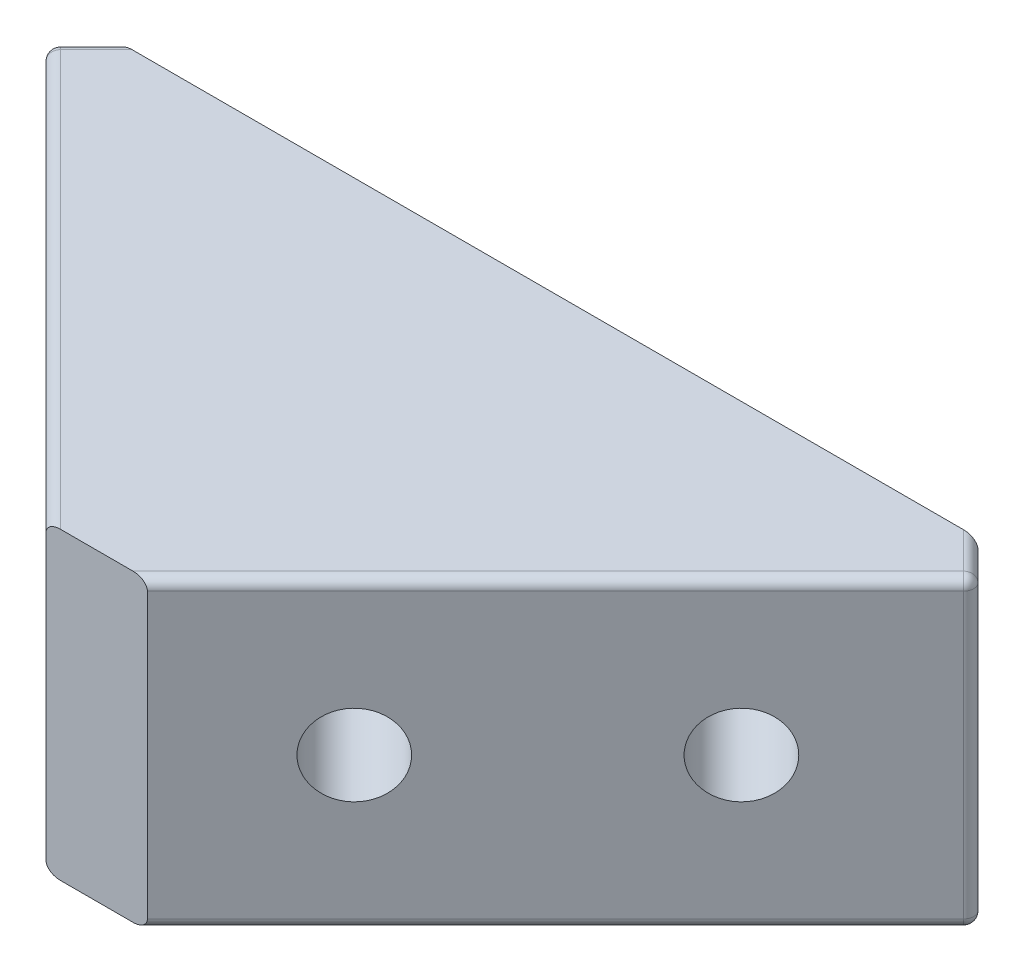
from build123d import *

# Parameters (mm, degrees)
BOSS_EXTRUDE1_DEPTH = 15
CUT_EXTRUDE5_REACH  = 43.908
SKETCH9_R           = 2
CUT_EXTRUDE6_REACH  = 43.908
SKETCH10_R          = 2
CUT_EXTRUDE7_REACH  = 40.079
FILLET1_R           = 0.5
CUT_EXTRUDE8_REACH  = 39.141
SKETCH11_R          = 3.5
CUT_EXTRUDE9_REACH  = 39.141
SKETCH12_R          = 3.5


with BuildPart() as part:
    # Sketch1 → Boss-Extrude1 (new body)
    with BuildSketch(Plane(origin=(0, 0, 0), x_dir=(1, 0, 0), z_dir=(0, 1, 0))):
        Polygon((-24.748737342, 0), (24.748737342, 0), (0, -24.748737342), align=None)
    extrude(amount=BOSS_EXTRUDE1_DEPTH)

    # Cut-Extrude5: up to this plane
    cut_extrude5_end = Plane(origin=(-24.748737342, 15, 0), z_dir=(0, 0, 1))
    # Sketch9 → Cut-Extrude5 (cut, up to the surface)
    with BuildSketch(Plane(origin=(12.374368671, 0, 12.374368671), x_dir=(0.7071067811865474, 0, -0.7071067811865477), z_dir=(0.7071067811865477, 0, 0.7071067811865474)), mode=Mode.PRIVATE) as cut_extrude5_sk1:
        with Locations((-6.75, 7.5)):
            Circle(SKETCH9_R)
    cut_extrude5_tool1 = split(extrude(cut_extrude5_sk1.sketch, amount=-CUT_EXTRUDE5_REACH, mode=Mode.PRIVATE), bisect_by=cut_extrude5_end, keep=Keep.BOTH, mode=Mode.PRIVATE)
    add(cut_extrude5_tool1.solids().sort_by_distance((7.601398, 7.5, 17.147339))[0], mode=Mode.SUBTRACT)
    # Sketch9 → Cut-Extrude5 (cut, up to the surface)
    with BuildSketch(Plane(origin=(12.374368671, 0, 12.374368671), x_dir=(0.7071067811865474, 0, -0.7071067811865477), z_dir=(0.7071067811865477, 0, 0.7071067811865474)), mode=Mode.PRIVATE) as cut_extrude5_sk2:
        with Locations((6.75, 7.5)):
            Circle(SKETCH9_R)
    cut_extrude5_tool2 = split(extrude(cut_extrude5_sk2.sketch, amount=-CUT_EXTRUDE5_REACH, mode=Mode.PRIVATE), bisect_by=cut_extrude5_end, keep=Keep.BOTH, mode=Mode.PRIVATE)
    add(cut_extrude5_tool2.solids().sort_by_distance((17.147339, 7.5, 7.601398))[0], mode=Mode.SUBTRACT)

    # Cut-Extrude6: up to this plane
    cut_extrude6_end = Plane(origin=(-24.748737342, 15, 0), z_dir=(0, 0, 1))
    # Sketch10 → Cut-Extrude6 (cut, up to the surface)
    with BuildSketch(Plane(origin=(-12.374368671, 0, 12.374368671), x_dir=(0.7071067811865472, 0, 0.7071067811865479), z_dir=(-0.7071067811865479, 0, 0.7071067811865472)), mode=Mode.PRIVATE) as cut_extrude6_sk1:
        with Locations((-6.75, 7.5)):
            Circle(SKETCH10_R)
    cut_extrude6_tool1 = split(extrude(cut_extrude6_sk1.sketch, amount=-CUT_EXTRUDE6_REACH, mode=Mode.PRIVATE), bisect_by=cut_extrude6_end, keep=Keep.BOTH, mode=Mode.PRIVATE)
    add(cut_extrude6_tool1.solids().sort_by_distance((-17.147339, 7.5, 7.601398))[0], mode=Mode.SUBTRACT)
    # Sketch10 → Cut-Extrude6 (cut, up to the surface)
    with BuildSketch(Plane(origin=(-12.374368671, 0, 12.374368671), x_dir=(0.7071067811865472, 0, 0.7071067811865479), z_dir=(-0.7071067811865479, 0, 0.7071067811865472)), mode=Mode.PRIVATE) as cut_extrude6_sk2:
        with Locations(Location((6.75, 7.5, 0), (0, 0, 90))):
            Circle(SKETCH10_R)
    cut_extrude6_tool2 = split(extrude(cut_extrude6_sk2.sketch, amount=-CUT_EXTRUDE6_REACH, mode=Mode.PRIVATE), bisect_by=cut_extrude6_end, keep=Keep.BOTH, mode=Mode.PRIVATE)
    add(cut_extrude6_tool2.solids().sort_by_distance((-7.601398, 7.5, 17.147339))[0], mode=Mode.SUBTRACT)

    # Sketch3 → Cut-Extrude7 (cut, up to next)
    with BuildSketch(Plane.XZ, mode=Mode.PRIVATE) as cut_extrude7_sk1:
        Polygon((-2.5, 22.248737342), (0, 24.748737342), (2.5, 22.248737342), align=None)
    cut_extrude7_tool1 = extrude(cut_extrude7_sk1.sketch, amount=-CUT_EXTRUDE7_REACH, mode=Mode.PRIVATE) & part.part
    # Sketch3 → Cut-Extrude7 (cut, up to next)
    with BuildSketch(Plane.XZ, mode=Mode.PRIVATE) as cut_extrude7_sk2:
        Polygon((-24.748737342, 0), (-22.980970389, 1.767766953), (-21.213203436, 0), align=None)
    cut_extrude7_tool2 = extrude(cut_extrude7_sk2.sketch, amount=-CUT_EXTRUDE7_REACH, mode=Mode.PRIVATE) & part.part
    # Sketch3 → Cut-Extrude7 (cut, up to next)
    with BuildSketch(Plane.XZ, mode=Mode.PRIVATE) as cut_extrude7_sk3:
        Polygon((24.748737342, 0), (21.213203436, 0), (22.980970389, 1.767766953), align=None)
    cut_extrude7_tool3 = extrude(cut_extrude7_sk3.sketch, amount=-CUT_EXTRUDE7_REACH, mode=Mode.PRIVATE) & part.part
    add(cut_extrude7_tool1.solids().sort_by_distance((0, 0, 23.082071))[0], mode=Mode.SUBTRACT)
    add(cut_extrude7_tool2.solids().sort_by_distance((-22.98097, 0, 0.589256))[0], mode=Mode.SUBTRACT)
    add(cut_extrude7_tool3.solids().sort_by_distance((22.98097, 0, 0.589256))[0], mode=Mode.SUBTRACT)

    # Fillet1
    fillet1_edges = [part.edges().sort_by_distance(p)[0] for p in [
        (-12.740485194, 0, 12.008252147),
        (12.740485194, 0, 12.008252147),
        (-12.740485194, 15, 12.008252147),
        (12.740485194, 15, 12.008252147),
        (22.980970389, 7.5, 1.767766953),
        (22.097086912, 15, 0.883883476),
        (22.097086912, 0, 0.883883476),
        (-22.097086912, 15, 0.883883476),
        (-22.980970389, 7.5, 1.767766953),
        (-22.097086912, 0, 0.883883476),
    ]]
    fillet(fillet1_edges, radius=FILLET1_R)

    # Cut-Extrude8: up to this plane
    cut_extrude8_end = Plane(origin=(-24.748737342, 15, 0), z_dir=(0, 0, 1))
    # Sketch11 → Cut-Extrude8 (cut, up to the surface)
    with BuildSketch(Plane(origin=(-8.131727984, 0, 8.131727984), x_dir=(0.7071067811865475, 0, 0.7071067811865477), z_dir=(-0.7071067811865477, 0, 0.7071067811865475)), mode=Mode.PRIVATE) as cut_extrude8_sk1:
        with Locations((-6.75, 7.5)):
            Circle(SKETCH11_R)
    cut_extrude8_tool1 = split(extrude(cut_extrude8_sk1.sketch, amount=-CUT_EXTRUDE8_REACH, mode=Mode.PRIVATE), bisect_by=cut_extrude8_end, keep=Keep.BOTH, mode=Mode.PRIVATE)
    add(cut_extrude8_tool1.solids().sort_by_distance((-12.904699, 7.5, 3.358757))[0], mode=Mode.SUBTRACT)
    # Sketch11 → Cut-Extrude8 (cut, up to the surface)
    with BuildSketch(Plane(origin=(-8.131727984, 0, 8.131727984), x_dir=(0.7071067811865475, 0, 0.7071067811865477), z_dir=(-0.7071067811865477, 0, 0.7071067811865475)), mode=Mode.PRIVATE) as cut_extrude8_sk2:
        with Locations((6.75, 7.5)):
            Circle(SKETCH11_R)
    cut_extrude8_tool2 = split(extrude(cut_extrude8_sk2.sketch, amount=-CUT_EXTRUDE8_REACH, mode=Mode.PRIVATE), bisect_by=cut_extrude8_end, keep=Keep.BOTH, mode=Mode.PRIVATE)
    add(cut_extrude8_tool2.solids().sort_by_distance((-3.358757, 7.5, 12.904699))[0], mode=Mode.SUBTRACT)

    # Cut-Extrude9: up to this plane
    cut_extrude9_end = Plane(origin=(-24.748737342, 15, 0), z_dir=(0, 0, 1))
    # Sketch12 → Cut-Extrude9 (cut, up to the surface)
    with BuildSketch(Plane(origin=(8.131727984, 0, 8.131727984), x_dir=(0.7071067811865474, 0, -0.7071067811865477), z_dir=(0.7071067811865477, 0, 0.7071067811865474)), mode=Mode.PRIVATE) as cut_extrude9_sk1:
        with Locations((6.75, 7.5)):
            Circle(SKETCH12_R)
    cut_extrude9_tool1 = split(extrude(cut_extrude9_sk1.sketch, amount=-CUT_EXTRUDE9_REACH, mode=Mode.PRIVATE), bisect_by=cut_extrude9_end, keep=Keep.BOTH, mode=Mode.PRIVATE)
    add(cut_extrude9_tool1.solids().sort_by_distance((12.904699, 7.5, 3.358757))[0], mode=Mode.SUBTRACT)
    # Sketch12 → Cut-Extrude9 (cut, up to the surface)
    with BuildSketch(Plane(origin=(8.131727984, 0, 8.131727984), x_dir=(0.7071067811865474, 0, -0.7071067811865477), z_dir=(0.7071067811865477, 0, 0.7071067811865474)), mode=Mode.PRIVATE) as cut_extrude9_sk2:
        with Locations(Location((-6.75, 7.5, 0), (0, 0, 90))):
            Circle(SKETCH12_R)
    cut_extrude9_tool2 = split(extrude(cut_extrude9_sk2.sketch, amount=-CUT_EXTRUDE9_REACH, mode=Mode.PRIVATE), bisect_by=cut_extrude9_end, keep=Keep.BOTH, mode=Mode.PRIVATE)
    add(cut_extrude9_tool2.solids().sort_by_distance((3.358757, 7.5, 12.904699))[0], mode=Mode.SUBTRACT)


solid = part.part
